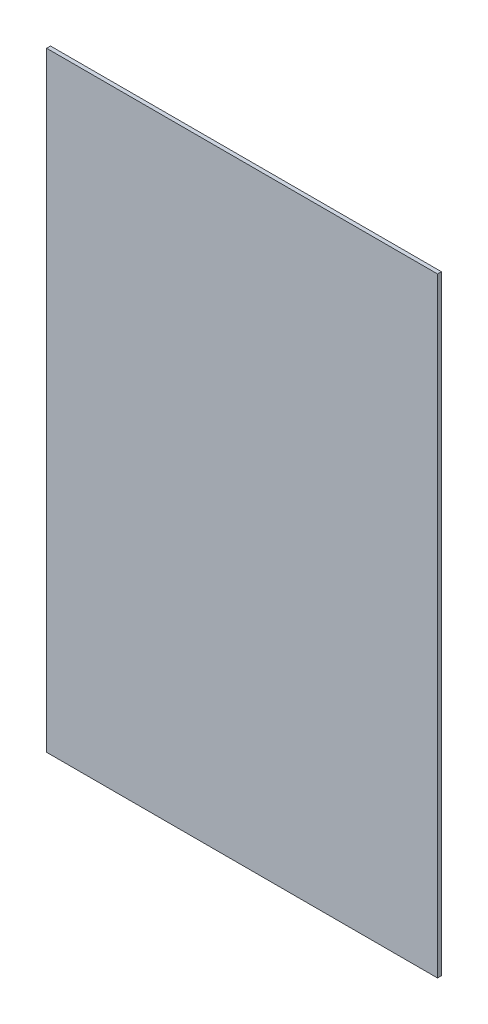
from build123d import *

# Parameters (mm, degrees)
SKETCH1_W           = 1270
SKETCH1_H           = 1981.2
BOSS_EXTRUDE1_DEPTH = 12.7


with BuildPart() as part:
    # Sketch1 → Boss-Extrude1 (new body)
    with BuildSketch(Plane.XY):
        Rectangle(SKETCH1_W, SKETCH1_H)
    extrude(amount=BOSS_EXTRUDE1_DEPTH)


solid = part.part
